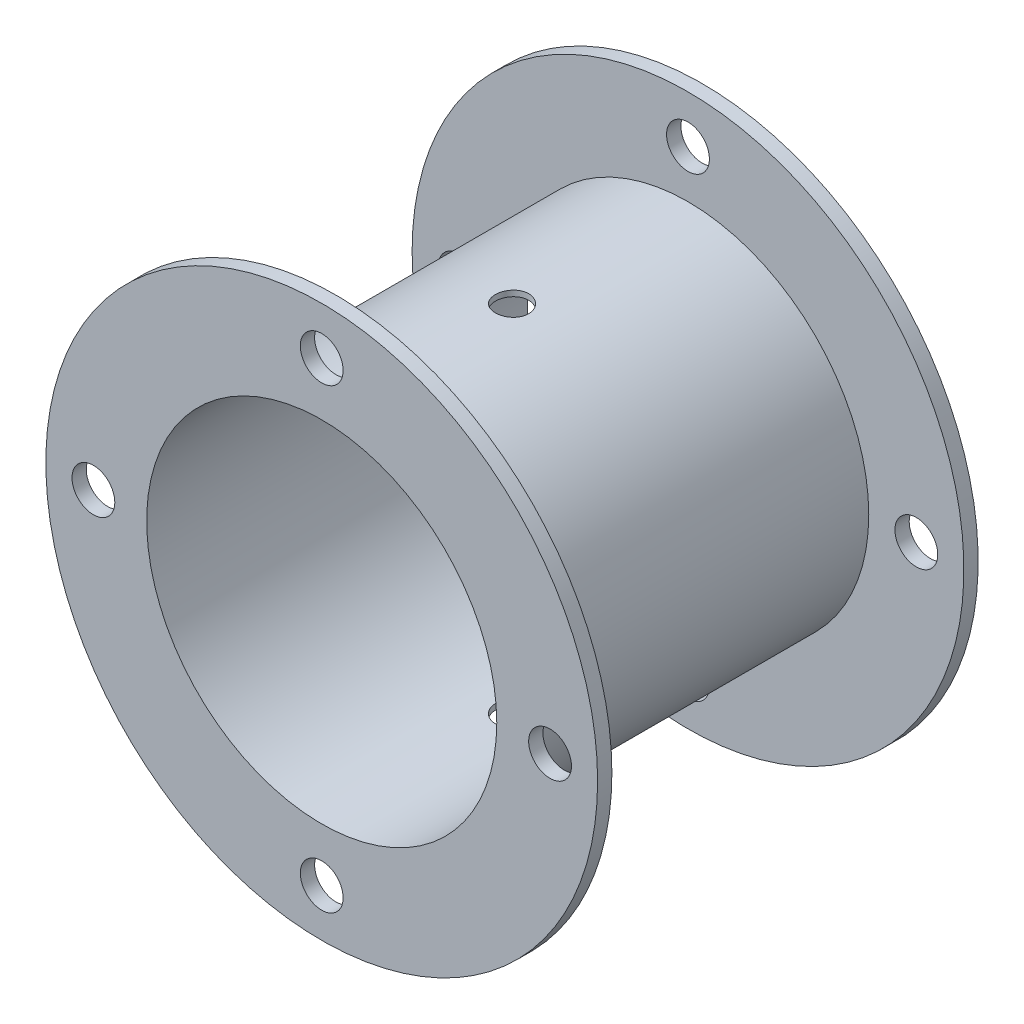
from build123d import *

# Parameters (mm, degrees)
SKETCH1_R               = 38
SKETCH1_R_2             = 36.8
BOSS_EXTRUDE1_DEPTH     = 80
CUT_EXTRUDE1_DEPTH      = 97.374270425
CUT_EXTRUDE1_DEPTH_BACK = 97.374270425
SKETCH2_R               = 3.5
BOSS_EXTRUDE2_START     = -3
SKETCH3_R               = 58
SKETCH3_R_2             = 38
SKETCH3_R_3             = 4.5
BOSS_EXTRUDE2_DEPTH     = 3
SKETCH4_R               = 58
SKETCH4_R_2             = 38
SKETCH4_R_3             = 4.5
BOSS_EXTRUDE3_DEPTH     = 3


with BuildPart() as part:
    # Sketch1 → Boss-Extrude1 (new body)
    with BuildSketch(Plane.XY):
        Circle(SKETCH1_R)
        Circle(SKETCH1_R_2, mode=Mode.SUBTRACT)
    extrude(amount=BOSS_EXTRUDE1_DEPTH)

    # Sketch2 → Cut-Extrude1 (cut, two sides: drawn at the far end of the back side and taken through both)
    with BuildSketch(Plane(origin=(0, 0, 0), x_dir=(1, 0, 0), z_dir=(0, 1, 0)).offset(-CUT_EXTRUDE1_DEPTH_BACK)):
        with Locations(Location((0, -40, 0), (0, 0, 270))):
            Circle(SKETCH2_R)
    extrude(amount=CUT_EXTRUDE1_DEPTH + CUT_EXTRUDE1_DEPTH_BACK, mode=Mode.SUBTRACT)

    # Sketch3 → Boss-Extrude2 (add)
    with BuildSketch(Plane.XY.offset(80).offset(BOSS_EXTRUDE2_START)):
        Circle(SKETCH3_R)
        Circle(SKETCH3_R_2, mode=Mode.SUBTRACT)
        with Locations((-48, 0)):
            Circle(SKETCH3_R_3, mode=Mode.SUBTRACT)
        with Locations((0, 48)):
            Circle(SKETCH3_R_3, mode=Mode.SUBTRACT)
        with Locations((48, 0)):
            Circle(SKETCH3_R_3, mode=Mode.SUBTRACT)
        with Locations((0, -48)):
            Circle(SKETCH3_R_3, mode=Mode.SUBTRACT)
    extrude(amount=BOSS_EXTRUDE2_DEPTH)

    # Sketch4 → Boss-Extrude3 (add)
    with BuildSketch(Plane(origin=(0, 0, 0), x_dir=(-1, 0, 0), z_dir=(0, 0, -1))):
        with Locations(Location((0, 0, 0), (0, 0, 180))):
            Circle(SKETCH4_R)
        Circle(SKETCH4_R_2, mode=Mode.SUBTRACT)
        with Locations(Location((48, 0, 0), (0, 0, 180))):
            Circle(SKETCH4_R_3, mode=Mode.SUBTRACT)
        with Locations(Location((0, -48, 0), (0, 0, 180))):
            Circle(SKETCH4_R_3, mode=Mode.SUBTRACT)
        with Locations(Location((-48, 0, 0), (0, 0, 180))):
            Circle(SKETCH4_R_3, mode=Mode.SUBTRACT)
        with Locations(Location((0, 48, 0), (0, 0, 180))):
            Circle(SKETCH4_R_3, mode=Mode.SUBTRACT)
    extrude(amount=-BOSS_EXTRUDE3_DEPTH)


solid = part.part
